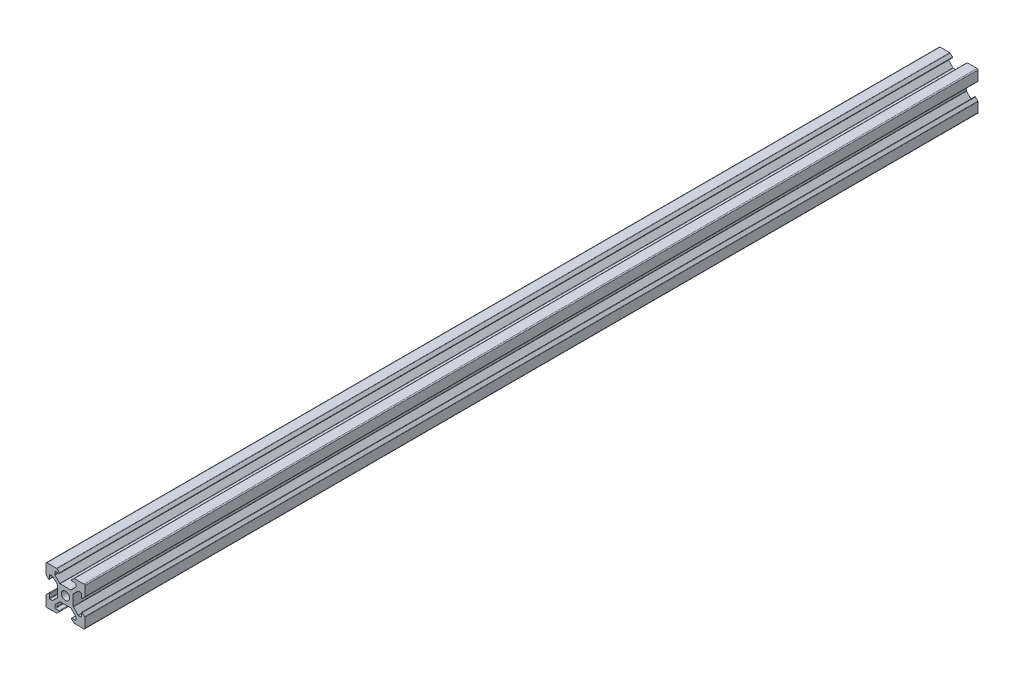
from build123d import *

# Parameters (mm, degrees)
MODEL_R             = 2.1
BOSS_EXTRUDE1_DEPTH = 460


with BuildPart() as part:
    # Model → Boss-Extrude1 (new body)
    with BuildSketch(Plane.XY):
        with BuildLine():
            Line((2012.931211125, 1381.800393717), (2012.931211125, 1378.200393717))
            Line((2012.931211125, 1378.200393717), (2012.931211125, 1377.300429431))
            ThreePointArc((2012.931211125, 1377.300429431), (2012.908374985, 1377.185624401), (2012.843343159, 1377.088297396))
            Line((2012.843343159, 1377.088297396), (2010.378662785, 1374.623617022))
            ThreePointArc((2010.378662785, 1374.623617022), (2010.297556948, 1374.569423834), (2010.20188609, 1374.550393717))
            Line((2010.20188609, 1374.550393717), (2008.881211125, 1374.550393717))
            ThreePointArc((2008.881211125, 1374.550393717), (2008.70443443, 1374.623617022), (2008.631211125, 1374.800393717))
            Line((2008.631211125, 1374.800393717), (2008.631211125, 1376.650393717))
            ThreePointArc((2008.631211125, 1376.650393717), (2008.476881983, 1376.8813636), (2008.20443443, 1376.827170412))
            Line((2008.20443443, 1376.827170412), (2007.01907909, 1375.641815073))
            ThreePointArc((2007.01907909, 1375.641815073), (2006.954047265, 1375.544488069), (2006.931211125, 1375.429683039))
            Line((2006.931211125, 1375.429683039), (2006.931211125, 1370.500393717))
            ThreePointArc((2006.931211125, 1370.500393717), (2007.077657734, 1370.146840327), (2007.431211125, 1370.000393717))
            Line((2007.431211125, 1370.000393717), (2012.360500447, 1370.000393717))
            ThreePointArc((2012.360500447, 1370.000393717), (2012.475305476, 1370.023229857), (2012.572632481, 1370.088261683))
            Line((2012.572632481, 1370.088261683), (2013.75798782, 1371.273617022))
            ThreePointArc((2013.75798782, 1371.273617022), (2013.812181008, 1371.546064575), (2013.581211125, 1371.700393717))
            Line((2013.581211125, 1371.700393717), (2011.731211125, 1371.700393717))
            ThreePointArc((2011.731211125, 1371.700393717), (2011.55443443, 1371.773617022), (2011.481211125, 1371.950393717))
            Line((2011.481211125, 1371.950393717), (2011.481211125, 1373.271068682))
            ThreePointArc((2011.481211125, 1373.271068682), (2011.500241242, 1373.36673954), (2011.55443443, 1373.447845377))
            Line((2011.55443443, 1373.447845377), (2014.033759465, 1375.927170412))
            ThreePointArc((2014.033759465, 1375.927170412), (2014.114865302, 1375.9813636), (2014.21053616, 1376.000393717))
            Line((2014.21053616, 1376.000393717), (2016.470233902, 1376.000393717))
            Line((2016.470233902, 1376.000393717), (2017.392188348, 1376.000393717))
            Line((2017.392188348, 1376.000393717), (2019.65188609, 1376.000393717))
            ThreePointArc((2019.65188609, 1376.000393717), (2019.747556948, 1375.9813636), (2019.828662785, 1375.927170412))
            Line((2019.828662785, 1375.927170412), (2022.30798782, 1373.447845377))
            ThreePointArc((2022.30798782, 1373.447845377), (2022.362181008, 1373.36673954), (2022.381211125, 1373.271068682))
            Line((2022.381211125, 1373.271068682), (2022.381211125, 1371.950393717))
            ThreePointArc((2022.381211125, 1371.950393717), (2022.30798782, 1371.773617022), (2022.131211125, 1371.700393717))
            Line((2022.131211125, 1371.700393717), (2020.281211125, 1371.700393717))
            ThreePointArc((2020.281211125, 1371.700393717), (2020.050241242, 1371.546064575), (2020.10443443, 1371.273617022))
            Line((2020.10443443, 1371.273617022), (2021.289789769, 1370.088261683))
            ThreePointArc((2021.289789769, 1370.088261683), (2021.387116773, 1370.023229857), (2021.501921803, 1370.000393717))
            Line((2021.501921803, 1370.000393717), (2026.431211125, 1370.000393717))
            ThreePointArc((2026.431211125, 1370.000393717), (2026.784764515, 1370.146840327), (2026.931211125, 1370.500393717))
            Line((2026.931211125, 1370.500393717), (2026.931211125, 1375.429683039))
            ThreePointArc((2026.931211125, 1375.429683039), (2026.908374985, 1375.544488069), (2026.843343159, 1375.641815073))
            Line((2026.843343159, 1375.641815073), (2025.65798782, 1376.827170412))
            ThreePointArc((2025.65798782, 1376.827170412), (2025.385540267, 1376.8813636), (2025.231211125, 1376.650393717))
            Line((2025.231211125, 1376.650393717), (2025.231211125, 1374.800393717))
            ThreePointArc((2025.231211125, 1374.800393717), (2025.15798782, 1374.623617022), (2024.981211125, 1374.550393717))
            Line((2024.981211125, 1374.550393717), (2023.66053616, 1374.550393717))
            ThreePointArc((2023.66053616, 1374.550393717), (2023.564865302, 1374.569423834), (2023.483759465, 1374.623617022))
            Line((2023.483759465, 1374.623617022), (2021.00443443, 1377.102942057))
            ThreePointArc((2021.00443443, 1377.102942057), (2020.950241242, 1377.184047894), (2020.931211125, 1377.279718752))
            Line((2020.931211125, 1377.279718752), (2020.931211125, 1379.539416494))
            Line((2020.931211125, 1379.539416494), (2020.931211125, 1380.46137094))
            Line((2020.931211125, 1380.46137094), (2020.931211125, 1382.721068682))
            ThreePointArc((2020.931211125, 1382.721068682), (2020.950241242, 1382.81673954), (2021.00443443, 1382.897845377))
            Line((2021.00443443, 1382.897845377), (2023.483759465, 1385.377170412))
            ThreePointArc((2023.483759465, 1385.377170412), (2023.564865302, 1385.4313636), (2023.66053616, 1385.450393717))
            Line((2023.66053616, 1385.450393717), (2024.981211125, 1385.450393717))
            ThreePointArc((2024.981211125, 1385.450393717), (2025.15798782, 1385.377170412), (2025.231211125, 1385.200393717))
            Line((2025.231211125, 1385.200393717), (2025.231211125, 1383.350393717))
            ThreePointArc((2025.231211125, 1383.350393717), (2025.385540267, 1383.119423834), (2025.65798782, 1383.173617022))
            Line((2025.65798782, 1383.173617022), (2026.843343159, 1384.358972361))
            ThreePointArc((2026.843343159, 1384.358972361), (2026.908374985, 1384.456299366), (2026.931211125, 1384.571104395))
            Line((2026.931211125, 1384.571104395), (2026.931211125, 1389.500393717))
            ThreePointArc((2026.931211125, 1389.500393717), (2026.784764516, 1389.853947108), (2026.431211125, 1390.000393717))
            Line((2026.431211125, 1390.000393717), (2021.501921803, 1390.000393717))
            ThreePointArc((2021.501921803, 1390.000393717), (2021.387116773, 1389.977557577), (2021.289789769, 1389.912525752))
            Line((2021.289789769, 1389.912525752), (2020.10443443, 1388.727170413))
            ThreePointArc((2020.10443443, 1388.727170413), (2020.050241242, 1388.454722859), (2020.281211125, 1388.300393717))
            Line((2020.281211125, 1388.300393717), (2022.131211125, 1388.300393717))
            ThreePointArc((2022.131211125, 1388.300393717), (2022.30798782, 1388.227170413), (2022.381211125, 1388.050393717))
            Line((2022.381211125, 1388.050393717), (2022.381211125, 1386.729718752))
            ThreePointArc((2022.381211125, 1386.729718752), (2022.362181008, 1386.634047894), (2022.30798782, 1386.552942057))
            Line((2022.30798782, 1386.552942057), (2019.828662785, 1384.073617022))
            ThreePointArc((2019.828662785, 1384.073617022), (2019.747556948, 1384.019423834), (2019.65188609, 1384.000393717))
            Line((2019.65188609, 1384.000393717), (2017.392188348, 1384.000393717))
            Line((2017.392188348, 1384.000393717), (2016.470233902, 1384.000393717))
            Line((2016.470233902, 1384.000393717), (2014.21053616, 1384.000393717))
            ThreePointArc((2014.21053616, 1384.000393717), (2014.114865302, 1384.019423834), (2014.033759465, 1384.073617022))
            Line((2014.033759465, 1384.073617022), (2011.55443443, 1386.552942057))
            ThreePointArc((2011.55443443, 1386.552942057), (2011.500241242, 1386.634047894), (2011.481211125, 1386.729718752))
            Line((2011.481211125, 1386.729718752), (2011.481211125, 1388.050393717))
            ThreePointArc((2011.481211125, 1388.050393717), (2011.55443443, 1388.227170413), (2011.731211125, 1388.300393717))
            Line((2011.731211125, 1388.300393717), (2013.581211125, 1388.300393717))
            ThreePointArc((2013.581211125, 1388.300393717), (2013.812181008, 1388.454722859), (2013.75798782, 1388.727170413))
            Line((2013.75798782, 1388.727170413), (2012.572632481, 1389.912525752))
            ThreePointArc((2012.572632481, 1389.912525752), (2012.475305477, 1389.977557577), (2012.360500447, 1390.000393717))
            Line((2012.360500447, 1390.000393717), (2007.431211125, 1390.000393717))
            ThreePointArc((2007.431211125, 1390.000393717), (2007.077657734, 1389.853947108), (2006.931211125, 1389.500393717))
            Line((2006.931211125, 1389.500393717), (2006.931211125, 1384.571104395))
            ThreePointArc((2006.931211125, 1384.571104395), (2006.954047265, 1384.456299366), (2007.019079091, 1384.358972361))
            Line((2007.019079091, 1384.358972361), (2008.20443443, 1383.173617022))
            ThreePointArc((2008.20443443, 1383.173617022), (2008.476881983, 1383.119423834), (2008.631211125, 1383.350393717))
            Line((2008.631211125, 1383.350393717), (2008.631211125, 1385.200393717))
            ThreePointArc((2008.631211125, 1385.200393717), (2008.70443443, 1385.377170412), (2008.881211125, 1385.450393717))
            Line((2008.881211125, 1385.450393717), (2010.20188609, 1385.450393717))
            ThreePointArc((2010.20188609, 1385.450393717), (2010.297556948, 1385.4313636), (2010.378662785, 1385.377170412))
            Line((2010.378662785, 1385.377170412), (2012.843343159, 1382.912490038))
            ThreePointArc((2012.843343159, 1382.912490038), (2012.908374985, 1382.815163033), (2012.931211125, 1382.700358004))
            Line((2012.931211125, 1382.700358004), (2012.931211125, 1381.800393717))
        make_face()
        with Locations((2016.931211125, 1380.000393717)):
            Circle(MODEL_R, mode=Mode.SUBTRACT)
    extrude(amount=BOSS_EXTRUDE1_DEPTH)


solid = part.part
